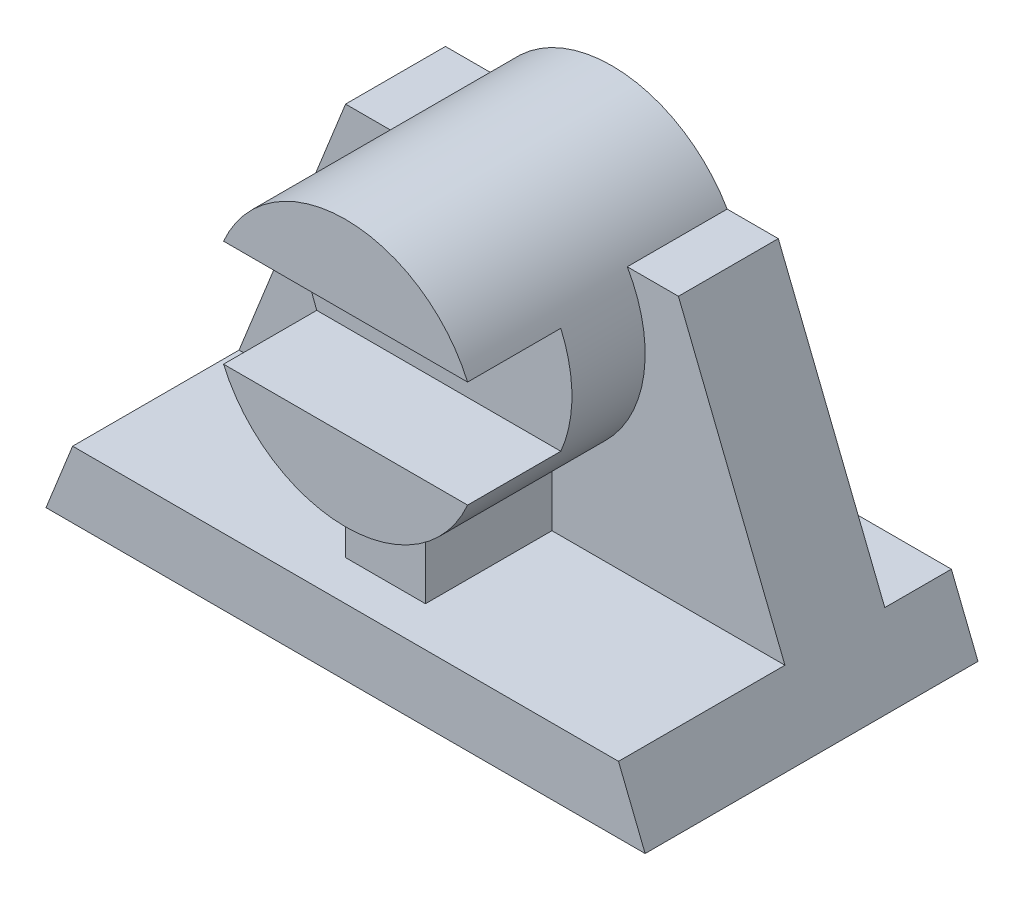
from build123d import *

# Parameters (mm, degrees)
BOSS_EXTRUDE1_DEPTH      = 40
BOSS_EXTRUDE1_DEPTH_BACK = 10
BOSS_EXTRUDE2_DEPTH      = 15
BOSS_EXTRUDE3_DEPTH      = 34
BOSS_EXTRUDE4_DEPTH      = 40
CUT_EXTRUDE1_DEPTH       = 14


with BuildPart() as part:
    # Sketch1 → Boss-Extrude1 (new, two sides: drawn at the far end of the back side and taken through both)
    with BuildSketch(Plane.XY.offset(-BOSS_EXTRUDE1_DEPTH_BACK)):
        Polygon((-60.696298415, -22.477026296), (-64.696298415, -32.477026296), (-44.696298415, -32.477026296), (-25.696298415, -32.477026296), (-13.696298415, -32.477026296), (25.303701585, -32.477026296), (21.303701585, -22.477026296), (-13.696298415, -22.477026296), (-25.696298415, -22.477026296), align=None)
    extrude(amount=BOSS_EXTRUDE1_DEPTH + BOSS_EXTRUDE1_DEPTH_BACK)

    # Sketch1<3> → Boss-Extrude2 (add)
    with BuildSketch(Plane.XY):
        with BuildLine():
            Line((-44.696298415, 17.522973704), (-60.696298415, -22.477026296))
            Line((-60.696298415, -22.477026296), (-25.696298415, -22.477026296))
            Line((-25.696298415, -22.477026296), (-25.696298415, -11.555810324))
            ThreePointArc((-25.696298415, -11.555810324), (-38.33377261, 0.267316902), (-37.016806491, 17.522973704))
            Line((-37.016806491, 17.522973704), (-44.696298415, 17.522973704))
        make_face()
        with BuildLine():
            Line((-13.696298415, -11.555810324), (-13.696298415, -22.477026296))
            Line((-13.696298415, -22.477026296), (21.303701585, -22.477026296))
            Line((21.303701585, -22.477026296), (5.303701585, 17.522973704))
            Line((5.303701585, 17.522973704), (-2.375790339, 17.522973704))
            ThreePointArc((-2.375790339, 17.522973704), (-1.05882422, 0.267316902), (-13.696298415, -11.555810324))
        make_face()
    extrude(amount=BOSS_EXTRUDE2_DEPTH)

    # Sketch1<4> → Boss-Extrude3 (add)
    with BuildSketch(Plane.XY):
        with BuildLine():
            Line((-25.696298415, -11.555810324), (-25.696298415, -22.477026296))
            Line((-25.696298415, -22.477026296), (-13.696298415, -22.477026296))
            Line((-13.696298415, -22.477026296), (-13.696298415, -11.555810324))
            ThreePointArc((-13.696298415, -11.555810324), (-19.696298415, -12.477026296), (-25.696298415, -11.555810324))
        make_face()
    extrude(amount=BOSS_EXTRUDE3_DEPTH)

    # Sketch1<6> → Boss-Extrude4 (add)
    with BuildSketch(Plane.XY):
        with BuildLine():
            ThreePointArc((-2.375790339, 17.522973704), (-19.696298415, 27.522973704), (-37.016806491, 17.522973704))
            ThreePointArc((-37.016806491, 17.522973704), (-38.33377261, 0.267316902), (-25.696298415, -11.555810324))
            ThreePointArc((-25.696298415, -11.555810324), (-19.696298415, -12.477026296), (-13.696298415, -11.555810324))
            ThreePointArc((-13.696298415, -11.555810324), (-3.571782918, -4.309185862), (0.303701585, 7.522973704))
            ThreePointArc((0.303701585, 7.522973704), (-0.377781889, 12.699354606), (-2.375790339, 17.522973704))
        make_face()
    extrude(amount=BOSS_EXTRUDE4_DEPTH)

    # Sketch2 → Cut-Extrude1 (cut)
    with BuildSketch(Plane.XY.offset(40)):
        with BuildLine():
            Line((-39.696298415, 15.522973704), (0.303701585, 15.522973704))
            ThreePointArc((0.303701585, 15.522973704), (8.303701585, 7.522973704), (0.303701585, -0.477026296))
            Line((0.303701585, -0.477026296), (-39.696298415, -0.477026296))
            ThreePointArc((-39.696298415, -0.477026296), (-47.696298415, 7.522973704), (-39.696298415, 15.522973704))
        make_face()
    extrude(amount=-CUT_EXTRUDE1_DEPTH, mode=Mode.SUBTRACT)


solid = part.part
